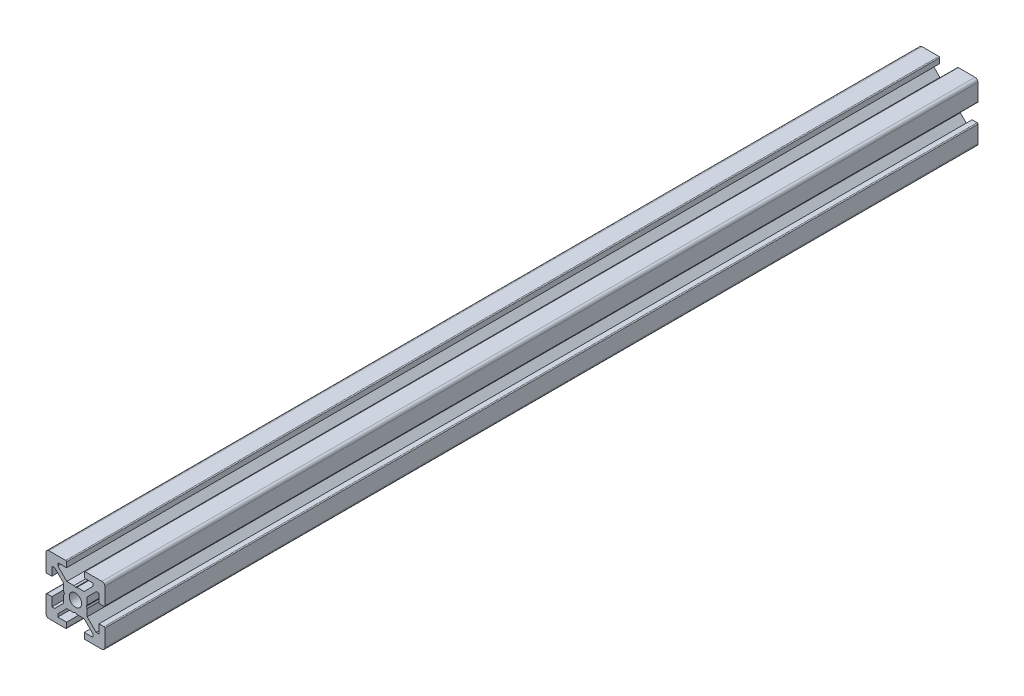
from build123d import *

# Parameters (mm, degrees)
BOSS_EXTRUDE1_DEPTH = 296.6
SKETCH2_W           = 355
SKETCH2_H           = 2.1


with BuildPart() as part:
    # Sketch1 → Boss-Extrude1 (new body)
    with BuildSketch(Plane.XY):
        with BuildLine():
            Line((-10, 9), (-10, 3.29999995))
            ThreePointArc((-10, 3.29999995), (-9.912132049, 3.087867916), (-9.7, 3))
            Line((-9.7, 3), (-8, 3))
            Line((-8, 3), (-8, 6))
            Line((-8, 6), (-7.060677, 6))
            Line((-7.060677, 6), (-4, 2.93932965))
            Line((-4, 2.93932965), (-4, 0.519615242))
            Line((-4, 0.519615242), (-3.699996283, -6.437e-06))
            Line((-3.699996283, -6.437e-06), (-4, -0.519628117))
            Line((-4, -0.519628117), (-4, -2.93933725))
            Line((-4, -2.93933725), (-7.0606695, -6))
            Line((-7.0606695, -6), (-8, -6))
            Line((-8, -6), (-8, -3))
            Line((-8, -3), (-9.7, -3))
            ThreePointArc((-9.7, -3), (-9.912132049, -3.087867916), (-10, -3.29999995))
            Line((-10, -3.29999995), (-10, -9))
            ThreePointArc((-10, -9), (-9.707106781, -9.707106781), (-9, -10))
            Line((-9, -10), (-3.29999995, -10))
            ThreePointArc((-3.29999995, -10), (-3.087867916, -9.912132049), (-3, -9.7))
            Line((-3, -9.7), (-3, -8))
            Line((-3, -8), (-6, -8))
            Line((-6, -8), (-6, -7.0606515))
            Line((-6, -7.0606515), (-2.9393489, -4))
            Line((-2.9393489, -4), (-0.519615242, -4))
            Line((-0.519615242, -4), (6.437e-06, -3.699996283))
            Line((6.437e-06, -3.699996283), (0.519628117, -4))
            Line((0.519628117, -4), (2.9393227, -4))
            Line((2.9393227, -4), (6, -7.060677))
            Line((6, -7.060677), (6, -8))
            Line((6, -8), (3, -8))
            Line((3, -8), (3, -9.7))
            ThreePointArc((3, -9.7), (3.087867916, -9.912132049), (3.29999995, -10))
            Line((3.29999995, -10), (9, -10))
            ThreePointArc((9, -10), (9.707106781, -9.707106781), (10, -9))
            Line((10, -9), (10, -3.29999995))
            ThreePointArc((10, -3.29999995), (9.912132049, -3.087867916), (9.7, -3))
            Line((9.7, -3), (8, -3))
            Line((8, -3), (8, -6))
            Line((8, -6), (7.0606435, -6))
            Line((7.0606435, -6), (4, -2.9393482))
            Line((4, -2.9393482), (4, -0.519615242))
            Line((4, -0.519615242), (3.699996283, 6.437e-06))
            Line((3.699996283, 6.437e-06), (4, 0.519628117))
            Line((4, 0.519628117), (4, 2.9393401))
            Line((4, 2.9393401), (7.060651, 6))
            Line((7.060651, 6), (8, 6))
            Line((8, 6), (8, 3))
            Line((8, 3), (9.7, 3))
            ThreePointArc((9.7, 3), (9.912132049, 3.087867916), (10, 3.29999995))
            Line((10, 3.29999995), (10, 9))
            ThreePointArc((10, 9), (9.707106781, 9.707106781), (9, 10))
            Line((9, 10), (3.29999995, 10))
            ThreePointArc((3.29999995, 10), (3.087867916, 9.912132049), (3, 9.7))
            Line((3, 9.7), (3, 8))
            Line((3, 8), (6, 8))
            Line((6, 8), (6, 7.060669))
            Line((6, 7.060669), (2.9393308, 4))
            Line((2.9393308, 4), (0.519615242, 4))
            Line((0.519615242, 4), (-6.437e-06, 3.699996283))
            Line((-6.437e-06, 3.699996283), (-0.519628117, 4))
            Line((-0.519628117, 4), (-2.93935655, 4))
            Line((-2.93935655, 4), (-6, 7.0606435))
            Line((-6, 7.0606435), (-6, 8))
            Line((-6, 8), (-3, 8))
            Line((-3, 8), (-3, 9.7))
            ThreePointArc((-3, 9.7), (-3.087867966, 9.912132034), (-3.3, 10))
            Line((-3.3, 10), (-9, 10))
            ThreePointArc((-9, 10), (-9.707106781, 9.707106781), (-10, 9))
        make_face()
    extrude(amount=-BOSS_EXTRUDE1_DEPTH)

    # Sketch2 → Cut-Revolve1 (revolve, cut)
    with BuildSketch(Plane(origin=(0, 0, 0), x_dir=(0, 0, -1), z_dir=(1, 0, 0))):
        with Locations((177.5, 1.05)):
            Rectangle(SKETCH2_W, SKETCH2_H)
    revolve(axis=Axis((0, 0, -355), (0, 0, 1)), mode=Mode.SUBTRACT)


solid = part.part
